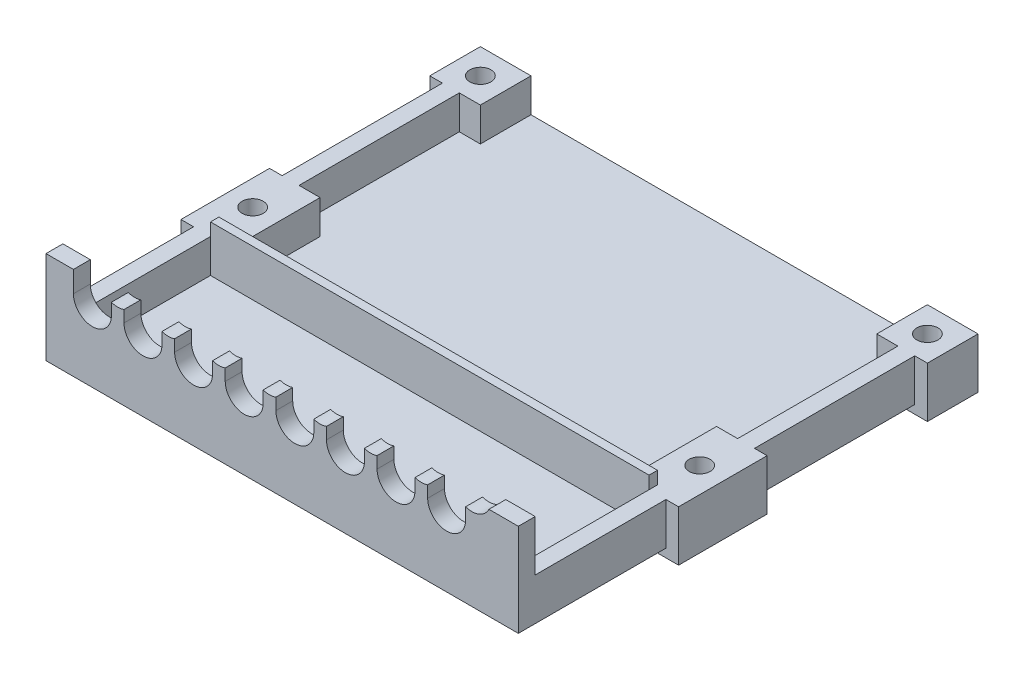
from build123d import *

# Parameters (mm, degrees)
SKETCH1_W            = 56
SKETCH1_H            = 53
BOSS_EXTRUDE1_DEPTH  = 2
BOSS_EXTRUDE2_DEPTH  = 4
SKETCH3_W            = 56
SKETCH3_H            = 2
BOSS_EXTRUDE3_DEPTH  = 6
SKETCH4_W            = 2.5
SKETCH4_H            = 6
BOSS_EXTRUDE4_DEPTH  = 4
SKETCH5_W            = 2.5
SKETCH5_H            = 6
BOSS_EXTRUDE5_DEPTH  = 4
SKETCH6_W            = 6
SKETCH6_H            = 6
BOSS_EXTRUDE6_DEPTH  = 1.5
SKETCH7_W            = 6
SKETCH7_H            = 6
BOSS_EXTRUDE7_DEPTH  = 1.5
SKETCH8_W            = 2
SKETCH8_H            = 4
BOSS_EXTRUDE8_DEPTH  = 2.5
SKETCH9_W            = 2
SKETCH9_H            = 4
BOSS_EXTRUDE9_DEPTH  = 2.5
SKETCH10_W           = 52
SKETCH10_H           = 1
BOSS_EXTRUDE10_DEPTH = 5.5
CUT_EXTRUDE1_DEPTH   = 5.5
SKETCH12_R           = 1.25
CUT_EXTRUDE2_DEPTH   = 15.5
SKETCH13_R           = 1.25
CUT_EXTRUDE3_DEPTH   = 15.5
SKETCH14_W           = 8.5
SKETCH14_H           = 4
BOSS_EXTRUDE11_DEPTH = 2.5
SKETCH15_W           = 8.5
SKETCH15_H           = 4
BOSS_EXTRUDE12_DEPTH = 2.5
SKETCH16_W           = 10.5
SKETCH16_H           = 6
BOSS_EXTRUDE13_DEPTH = 1.5
SKETCH17_W           = 10.5
SKETCH17_H           = 6
BOSS_EXTRUDE14_DEPTH = 1.5
SKETCH18_R           = 1.25
CUT_EXTRUDE4_DEPTH   = 10
SKETCH19_R           = 1.25
CUT_EXTRUDE5_DEPTH   = 10
CHAMFER4_SIZE        = 1


with BuildPart() as part:
    # Sketch1 → Boss-Extrude1 (new body)
    with BuildSketch(Plane(origin=(0, 0, 0), x_dir=(1, 0, 0), z_dir=(0, 1, 0))):
        Rectangle(SKETCH1_W, SKETCH1_H)
    extrude(amount=BOSS_EXTRUDE1_DEPTH)

    # Sketch2 → Boss-Extrude2 (add)
    with BuildSketch(Plane(origin=(0, 2, 0), x_dir=(1, 0, 0), z_dir=(0, 1, 0))):
        Polygon((-26, 26.5), (-28, 26.5), (-28, -23), (-28, -26.5), (-26, -26.5), (26, -26.5), (28, -26.5), (28, -23), (28, 26.5), (26, 26.5), (26, -24.5), (-26, -24.5), align=None)
    extrude(amount=BOSS_EXTRUDE2_DEPTH)

    # Sketch3 → Boss-Extrude3 (add)
    with BuildSketch(Plane(origin=(0, 6, 0), x_dir=(1, 0, 0), z_dir=(0, 1, 0))):
        with Locations((0, -25.5)):
            Rectangle(SKETCH3_W, SKETCH3_H)
    extrude(amount=BOSS_EXTRUDE3_DEPTH)

    # Sketch4 → Boss-Extrude4 (add)
    with BuildSketch(Plane(origin=(0, 2, 0), x_dir=(1, 0, 0), z_dir=(0, 1, 0))):
        with Locations((-24.75, 23.5)):
            Rectangle(SKETCH4_W, SKETCH4_H)
    extrude(amount=BOSS_EXTRUDE4_DEPTH)

    # Sketch5 → Boss-Extrude5 (add)
    with BuildSketch(Plane(origin=(0, 2, 0), x_dir=(1, 0, 0), z_dir=(0, 1, 0))):
        with Locations((24.75, 23.5)):
            Rectangle(SKETCH5_W, SKETCH5_H)
    extrude(amount=BOSS_EXTRUDE5_DEPTH)

    # Sketch6 → Boss-Extrude6 (add)
    with BuildSketch(Plane.ZY.offset(28)):
        with Locations((-23.5, 3)):
            Rectangle(SKETCH6_W, SKETCH6_H)
    extrude(amount=BOSS_EXTRUDE6_DEPTH)

    # Sketch7 → Boss-Extrude7 (add)
    with BuildSketch(Plane(origin=(28, 0, 0), x_dir=(0, 0, -1), z_dir=(1, 0, 0))):
        with Locations((23.5, 3)):
            Rectangle(SKETCH7_W, SKETCH7_H)
    extrude(amount=BOSS_EXTRUDE7_DEPTH)

    # Sketch8 → Boss-Extrude8 (add)
    with BuildSketch(Plane.ZY.offset(-26)):
        with Locations((-0.5, 4)):
            Rectangle(SKETCH8_W, SKETCH8_H)
    extrude(amount=BOSS_EXTRUDE8_DEPTH)

    # Sketch9 → Boss-Extrude9 (add)
    with BuildSketch(Plane(origin=(-26, 0, 0), x_dir=(0, 0, -1), z_dir=(1, 0, 0))):
        with Locations((0.5, 4)):
            Rectangle(SKETCH9_W, SKETCH9_H)
    extrude(amount=BOSS_EXTRUDE9_DEPTH)

    # Sketch10 → Boss-Extrude10 (add)
    with BuildSketch(Plane(origin=(0, 2, 0), x_dir=(1, 0, 0), z_dir=(0, 1, 0))):
        with Locations((0, -8.5)):
            Rectangle(SKETCH10_W, SKETCH10_H)
    extrude(amount=BOSS_EXTRUDE10_DEPTH)

    # Sketch11 → Cut-Extrude1 (cut)
    with BuildSketch(Plane.XY.offset(26.5)):
        with BuildLine():
            Line((-24.75, 9.5), (-24.75, 12))
            Line((-24.75, 12), (24.75, 13))
            ThreePointArc((24.75, 13), (23.799038106, 11.162882693), (21.75, 10.878679656))
            Line((21.75, 10.878679656), (21.75, 9.5))
            ThreePointArc((21.75, 9.5), (19.5, 7.25), (17.25, 9.5))
            Line((17.25, 9.5), (17.25, 10.878679656))
            ThreePointArc((17.25, 10.878679656), (16.5, 10.75), (15.75, 10.878679656))
            Line((15.75, 10.878679656), (15.75, 9.5))
            ThreePointArc((15.75, 9.5), (13.5, 7.25), (11.25, 9.5))
            Line((11.25, 9.5), (11.25, 10.878679656))
            ThreePointArc((11.25, 10.878679656), (10.5, 10.75), (9.75, 10.878679656))
            Line((9.75, 10.878679656), (9.75, 9.5))
            ThreePointArc((9.75, 9.5), (7.5, 7.25), (5.25, 9.5))
            Line((5.25, 9.5), (5.25, 10.878679656))
            ThreePointArc((5.25, 10.878679656), (4.5, 10.75), (3.75, 10.878679656))
            Line((3.75, 10.878679656), (3.75, 9.5))
            ThreePointArc((3.75, 9.5), (1.5, 7.25), (-0.75, 9.5))
            Line((-0.75, 9.5), (-0.75, 10.878679656))
            ThreePointArc((-0.75, 10.878679656), (-1.5, 10.75), (-2.25, 10.878679656))
            Line((-2.25, 10.878679656), (-2.25, 9.5))
            ThreePointArc((-2.25, 9.5), (-4.5, 7.25), (-6.75, 9.5))
            Line((-6.75, 9.5), (-6.75, 10.878679656))
            ThreePointArc((-6.75, 10.878679656), (-7.5, 10.75), (-8.25, 10.878679656))
            Line((-8.25, 10.878679656), (-8.25, 9.5))
            ThreePointArc((-8.25, 9.5), (-10.5, 7.25), (-12.75, 9.5))
            Line((-12.75, 9.5), (-12.75, 10.878679656))
            ThreePointArc((-12.75, 10.878679656), (-13.5, 10.75), (-14.25, 10.878679656))
            Line((-14.25, 10.878679656), (-14.25, 9.5))
            ThreePointArc((-14.25, 9.5), (-16.5, 7.25), (-18.75, 9.5))
            Line((-18.75, 9.5), (-18.75, 10.878679656))
            ThreePointArc((-18.75, 10.878679656), (-19.5, 10.75), (-20.25, 10.878679656))
            Line((-20.25, 10.878679656), (-20.25, 9.5))
            ThreePointArc((-20.25, 9.5), (-22.5, 7.25), (-24.75, 9.5))
        make_face()
    extrude(amount=-CUT_EXTRUDE1_DEPTH, mode=Mode.SUBTRACT)

    # Sketch12 → Cut-Extrude2 (cut)
    with BuildSketch(Plane(origin=(0, 6, 0), x_dir=(1, 0, 0), z_dir=(0, 1, 0))):
        with Locations(Location((26.5, 23.5, 0), (0, 0, 270))):
            Circle(SKETCH12_R)
    extrude(amount=-CUT_EXTRUDE2_DEPTH, mode=Mode.SUBTRACT)

    # Sketch13 → Cut-Extrude3 (cut)
    with BuildSketch(Plane(origin=(0, 6, 0), x_dir=(1, 0, 0), z_dir=(0, 1, 0))):
        with Locations(Location((-26.5, 23.5, 0), (0, 0, 270))):
            Circle(SKETCH13_R)
    extrude(amount=-CUT_EXTRUDE3_DEPTH, mode=Mode.SUBTRACT)

    # Sketch14 → Boss-Extrude11 (add)
    with BuildSketch(Plane(origin=(-26, 0, 0), x_dir=(0, 0, -1), z_dir=(1, 0, 0))):
        with Locations((-4.75, 4)):
            Rectangle(SKETCH14_W, SKETCH14_H)
    extrude(amount=BOSS_EXTRUDE11_DEPTH)

    # Sketch15 → Boss-Extrude12 (add)
    with BuildSketch(Plane.ZY.offset(-26)):
        with Locations((4.75, 4)):
            Rectangle(SKETCH15_W, SKETCH15_H)
    extrude(amount=BOSS_EXTRUDE12_DEPTH)

    # Sketch16 → Boss-Extrude13 (add)
    with BuildSketch(Plane.ZY.offset(28)):
        with Locations((3.75, 3)):
            Rectangle(SKETCH16_W, SKETCH16_H)
    extrude(amount=BOSS_EXTRUDE13_DEPTH)

    # Sketch17 → Boss-Extrude14 (add)
    with BuildSketch(Plane(origin=(28, 0, 0), x_dir=(0, 0, -1), z_dir=(1, 0, 0))):
        with Locations((-3.75, 3)):
            Rectangle(SKETCH17_W, SKETCH17_H)
    extrude(amount=BOSS_EXTRUDE14_DEPTH)

    # Sketch18 → Cut-Extrude4 (cut)
    with BuildSketch(Plane(origin=(0, 6, 0), x_dir=(1, 0, 0), z_dir=(0, 1, 0))):
        with Locations(Location((26.5, -3.5, 0), (0, 0, 270))):
            Circle(SKETCH18_R)
    extrude(amount=-CUT_EXTRUDE4_DEPTH, mode=Mode.SUBTRACT)

    # Sketch19 → Cut-Extrude5 (cut)
    with BuildSketch(Plane(origin=(0, 6, 0), x_dir=(1, 0, 0), z_dir=(0, 1, 0))):
        with Locations(Location((-26.5, -3.5, 0), (0, 0, 270))):
            Circle(SKETCH19_R)
    extrude(amount=-CUT_EXTRUDE5_DEPTH, mode=Mode.SUBTRACT)

    # Chamfer4
    chamfer4_edges = [part.edges().sort_by_distance(p)[0] for p in [
        (-28, 0, 17.75),
        (28, 0, -11),
        (0, 0, 26.5),
        (28, 0, 17.75),
        (-28, 0, -11),
    ]]
    chamfer(chamfer4_edges, length=CHAMFER4_SIZE)


solid = part.part
